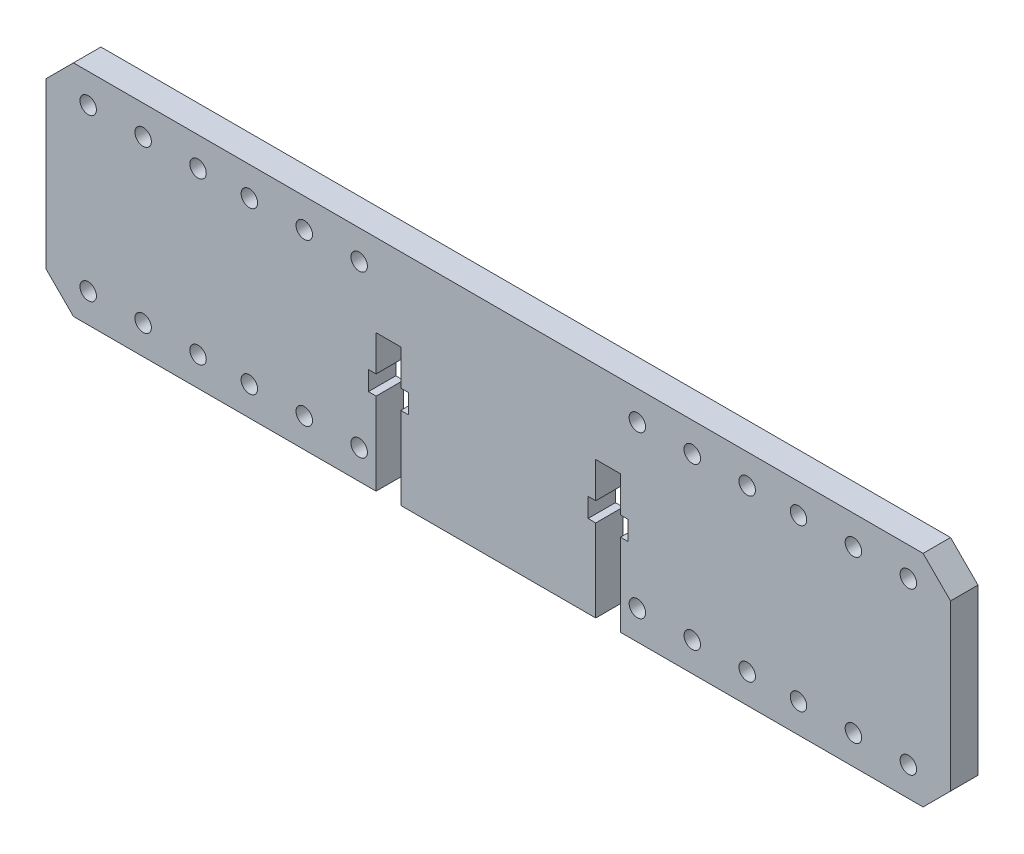
from build123d import *

# Parameters (mm, degrees)
SKETCH_1_R      = 1.5
EXTRUDE_1_DEPTH = 5
CHAMFER_1_SIZE  = 5


with BuildPart() as part:
    # 草图1 → 凸台-拉伸1 (new body)
    with BuildSketch(Plane.XY):
        Polygon((-82.356314269, -20), (-22.25, -20), (-22.25, -5), (-23.65, -5), (-23.65, -1.5), (-22.25, -1.5), (-22.25, 5), (-17.75, 5), (-17.75, -1.5), (-16.35, -1.5), (-16.35, -5), (-17.75, -5), (-17.75, -20), (17.75, -20), (17.75, -5), (16.35, -5), (16.35, -1.5), (17.75, -1.5), (17.75, 5), (22.25, 5), (22.25, -1.5), (23.65, -1.5), (23.65, -5), (22.25, -5), (22.25, -20), (82.356314269, -20), (82.356314269, 20), (-82.356314269, 20), align=None)
        with Locations((-64.67246571, 14.67246571)):
            Circle(SKETCH_1_R, mode=Mode.SUBTRACT)
        with Locations((-35.32753429, 14.67246571)):
            Circle(SKETCH_1_R, mode=Mode.SUBTRACT)
        with Locations((-64.67246571, -14.67246571)):
            Circle(SKETCH_1_R, mode=Mode.SUBTRACT)
        with Locations((-35.32753429, -14.67246571)):
            Circle(SKETCH_1_R, mode=Mode.SUBTRACT)
        with Locations(Location((64.67246571, 14.67246571, 0), (0, 0, 180))):
            Circle(SKETCH_1_R, mode=Mode.SUBTRACT)
        with Locations(Location((64.67246571, -14.67246571, 0), (0, 0, 180))):
            Circle(SKETCH_1_R, mode=Mode.SUBTRACT)
        with Locations(Location((35.32753429, -14.67246571, 0), (0, 0, 180))):
            Circle(SKETCH_1_R, mode=Mode.SUBTRACT)
        with Locations(Location((35.32753429, 14.67246571, 0), (0, 0, 180))):
            Circle(SKETCH_1_R, mode=Mode.SUBTRACT)
        with Locations((-54.67246571, 14.67246571)):
            Circle(SKETCH_1_R, mode=Mode.SUBTRACT)
        with Locations((-25.32753429, 14.67246571)):
            Circle(SKETCH_1_R, mode=Mode.SUBTRACT)
        with Locations((-54.67246571, -14.67246571)):
            Circle(SKETCH_1_R, mode=Mode.SUBTRACT)
        with Locations((-25.32753429, -14.67246571)):
            Circle(SKETCH_1_R, mode=Mode.SUBTRACT)
        with Locations((-74.67246571, 14.67246571)):
            Circle(SKETCH_1_R, mode=Mode.SUBTRACT)
        with Locations((-45.32753429, 14.67246571)):
            Circle(SKETCH_1_R, mode=Mode.SUBTRACT)
        with Locations((-45.32753429, -14.67246571)):
            Circle(SKETCH_1_R, mode=Mode.SUBTRACT)
        with Locations((-74.67246571, -14.67246571)):
            Circle(SKETCH_1_R, mode=Mode.SUBTRACT)
        with Locations(Location((45.32753429, 14.67246571, 0), (0, 0, 180))):
            Circle(SKETCH_1_R, mode=Mode.SUBTRACT)
        with Locations(Location((45.32753429, -14.67246571, 0), (0, 0, 180))):
            Circle(SKETCH_1_R, mode=Mode.SUBTRACT)
        with Locations(Location((74.67246571, -14.67246571, 0), (0, 0, 180))):
            Circle(SKETCH_1_R, mode=Mode.SUBTRACT)
        with Locations(Location((74.67246571, 14.67246571, 0), (0, 0, 180))):
            Circle(SKETCH_1_R, mode=Mode.SUBTRACT)
        with Locations(Location((25.32753429, 14.67246571, 0), (0, 0, 180))):
            Circle(SKETCH_1_R, mode=Mode.SUBTRACT)
        with Locations(Location((25.32753429, -14.67246571, 0), (0, 0, 180))):
            Circle(SKETCH_1_R, mode=Mode.SUBTRACT)
        with Locations(Location((54.67246571, -14.67246571, 0), (0, 0, 180))):
            Circle(SKETCH_1_R, mode=Mode.SUBTRACT)
        with Locations(Location((54.67246571, 14.67246571, 0), (0, 0, 180))):
            Circle(SKETCH_1_R, mode=Mode.SUBTRACT)
    extrude(amount=EXTRUDE_1_DEPTH)

    # 倒角1
    chamfer_1_edges = [part.edges().sort_by_distance(p)[0] for p in [
        (-82.356314269, 20, 2.5),
        (82.356314269, 20, 2.5),
        (82.356314269, -20, 2.5),
        (-82.356314269, -20, 2.5),
    ]]
    chamfer(chamfer_1_edges, length=CHAMFER_1_SIZE)


solid = part.part
